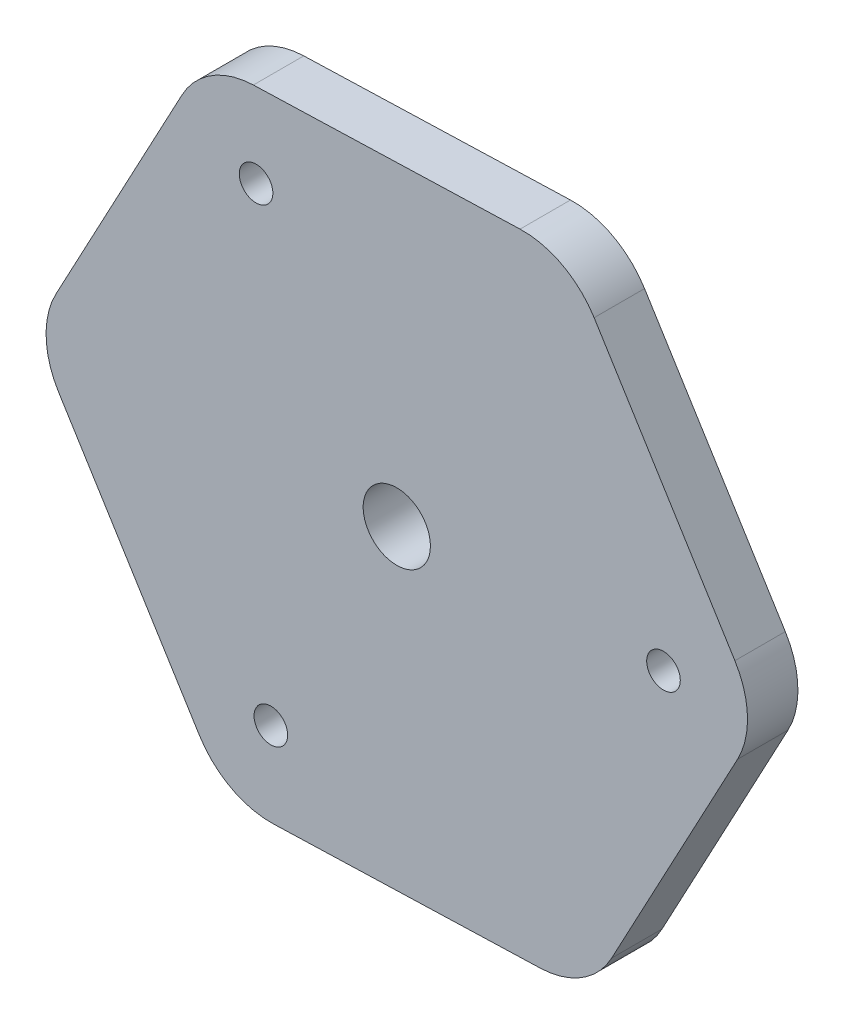
from build123d import *

# Parameters (mm, degrees)
SKETCH1_R           = 2
SKETCH1_R_2         = 4
BOSS_EXTRUDE1_DEPTH = 6


with BuildPart() as part:
    # Sketch1 → Boss-Extrude1 (new body)
    with BuildSketch(Plane.XY):
        with BuildLine():
            Line((-52.979773801, 153.114027001), (-36.230800058, 126.13616178))
            ThreePointArc((-36.230800058, 126.13616178), (-34.731745269, 121.181592779), (-35.910810241, 116.141282765))
            Line((-35.910810241, 116.141282765), (-50.89983999, 88.147313406))
            ThreePointArc((-50.89983999, 88.147313406), (-54.441095215, 84.371809376), (-59.395664216, 82.872754588))
            Line((-59.395664216, 82.872754588), (-91.133667709, 81.856650449))
            ThreePointArc((-91.133667709, 81.856650449), (-96.173977723, 83.035715421), (-99.949481752, 86.576970646))
            Line((-99.949481752, 86.576970646), (-116.698455495, 113.554835867))
            ThreePointArc((-116.698455495, 113.554835867), (-118.197510284, 118.509404868), (-117.018445312, 123.549714881))
            Line((-117.018445312, 123.549714881), (-102.029415563, 151.543684241))
            ThreePointArc((-102.029415563, 151.543684241), (-98.488160338, 155.31918827), (-93.533591337, 156.818243059))
            Line((-93.533591337, 156.818243059), (-61.795587844, 157.834347197))
            ThreePointArc((-61.795587844, 157.834347197), (-56.75527783, 156.655282226), (-52.979773801, 153.114027001))
        make_face()
        with Locations((-91.453657526, 91.851529464)):
            Circle(SKETCH1_R, mode=Mode.SUBTRACT)
        with Locations((-44.726624284, 120.861602962)):
            Circle(SKETCH1_R, mode=Mode.SUBTRACT)
        with Locations((-76.464627777, 119.845498823)):
            Circle(SKETCH1_R_2, mode=Mode.SUBTRACT)
        with Locations((-93.21360152, 146.823364044)):
            Circle(SKETCH1_R, mode=Mode.SUBTRACT)
    extrude(amount=BOSS_EXTRUDE1_DEPTH)


solid = part.part
